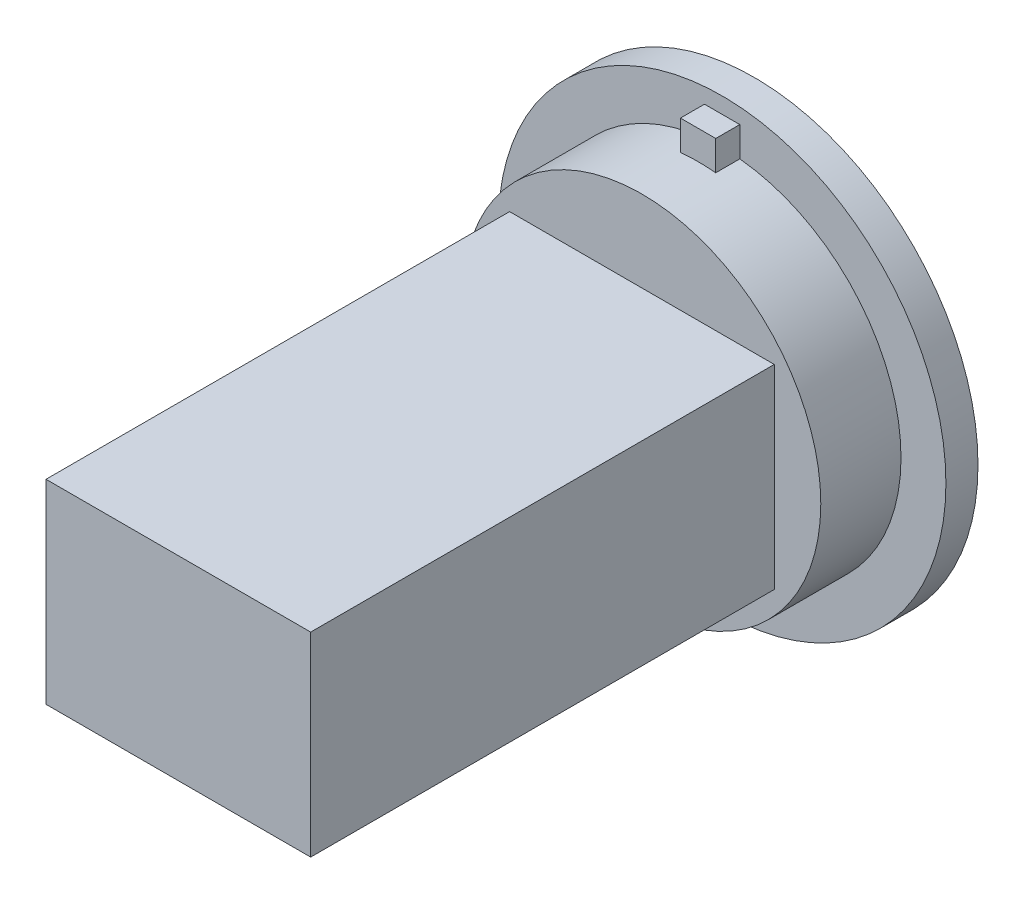
from build123d import *

# Parameters (mm, degrees)
ESQUISSE1_R             = 13.95
BOSS_EXTRU_1_DEPTH      = 2
ESQUISSE2_R             = 11.15
BOSS_EXTRU_2_DEPTH      = 5
BOSS_EXTRU_3_DEPTH      = 1.5
ESQUISSE4_W             = 16.5
ESQUISSE4_H             = 12.15
BOSS_EXTRU_4_DEPTH      = 28.9
ENL_V_MAT_EXTRU_1_DEPTH = 10


with BuildPart() as part:
    # Esquisse1 → Boss.-Extru.1 (new body)
    with BuildSketch(Plane.XY):
        Circle(ESQUISSE1_R)
    extrude(amount=BOSS_EXTRU_1_DEPTH)

    # Esquisse2 → Boss.-Extru.2 (add)
    with BuildSketch(Plane.XY.offset(2)):
        Circle(ESQUISSE2_R)
    extrude(amount=BOSS_EXTRU_2_DEPTH)

    # Esquisse3 → Boss.-Extru.3 (add)
    with BuildSketch(Plane.XY.offset(2)):
        with BuildLine():
            ThreePointArc((-1.1, 11.095607239), (0, 11.15), (1.1, 11.095607239))
            Line((1.1, 11.095607239), (1.1, 12.95))
            Line((1.1, 12.95), (-1.1, 12.95))
            Line((-1.1, 12.95), (-1.1, 11.095607239))
        make_face()
    extrude(amount=BOSS_EXTRU_3_DEPTH)

    # Esquisse4 → Boss.-Extru.4 (add)
    with BuildSketch(Plane.XY.offset(7)):
        Rectangle(ESQUISSE4_W, ESQUISSE4_H)
    extrude(amount=BOSS_EXTRU_4_DEPTH)

    # Esquisse6 → Enlèv. mat.-Extru.1 (cut)
    with BuildSketch(Plane(origin=(0, 0, 0), x_dir=(-1, 0, 0), z_dir=(0, 0, -1))):
        Polygon((6, 4), (1.5, 4), (1.5, 6), (-1.5, 6), (-1.5, 4), (-6, 4), (-6, -4), (6, -4), align=None)
    extrude(amount=-ENL_V_MAT_EXTRU_1_DEPTH, mode=Mode.SUBTRACT)


solid = part.part
